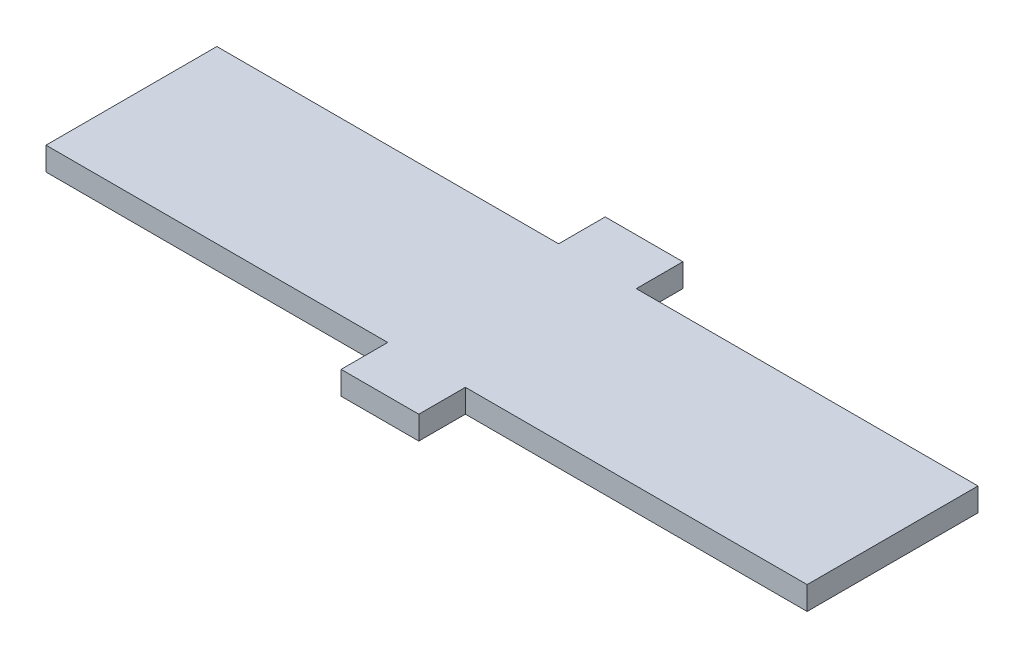
from build123d import *

# Parameters (mm, degrees)
SKETCH1_W           = 49
SKETCH1_H           = 11
BOSS_EXTRUDE1_DEPTH = 1.5
SKETCH2_W           = 5
SKETCH2_H           = 3
BOSS_EXTRUDE2_DEPTH = 1.5
SKETCH3_W           = 5
SKETCH3_H           = 3
BOSS_EXTRUDE3_DEPTH = 1.5


with BuildPart() as part:
    # Sketch1 → Boss-Extrude1 (new body)
    with BuildSketch(Plane(origin=(0, 0, 0), x_dir=(1, 0, 0), z_dir=(0, 1, 0))):
        Rectangle(SKETCH1_W, SKETCH1_H)
    extrude(amount=BOSS_EXTRUDE1_DEPTH)

    # Sketch2 → Boss-Extrude2 (add)
    with BuildSketch(Plane(origin=(0, 1.5, 0), x_dir=(1, 0, 0), z_dir=(0, 1, 0))):
        with Locations((0, 7)):
            Rectangle(SKETCH2_W, SKETCH2_H)
    extrude(amount=-BOSS_EXTRUDE2_DEPTH)

    # Sketch3 → Boss-Extrude3 (add)
    with BuildSketch(Plane(origin=(0, 1.5, 0), x_dir=(1, 0, 0), z_dir=(0, 1, 0))):
        with Locations((0, -7)):
            Rectangle(SKETCH3_W, SKETCH3_H)
    extrude(amount=-BOSS_EXTRUDE3_DEPTH)


solid = part.part
